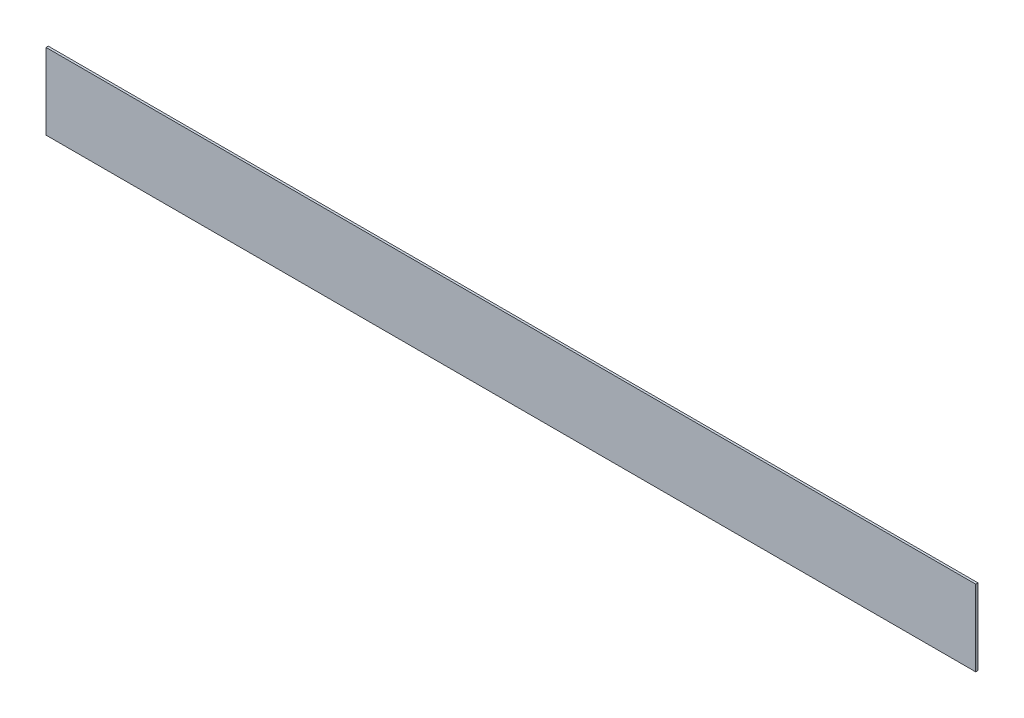
from build123d import *

# Parameters (mm, degrees)
SKETCH_1_W      = 2056
SKETCH_1_H      = 168
EXTRUDE_1_DEPTH = 5


with BuildPart() as part:
    # 草图1 → 凸台-拉伸1 (new body)
    with BuildSketch(Plane.XY):
        with Locations((1028, 84)):
            Rectangle(SKETCH_1_W, SKETCH_1_H)
    extrude(amount=EXTRUDE_1_DEPTH)


solid = part.part
